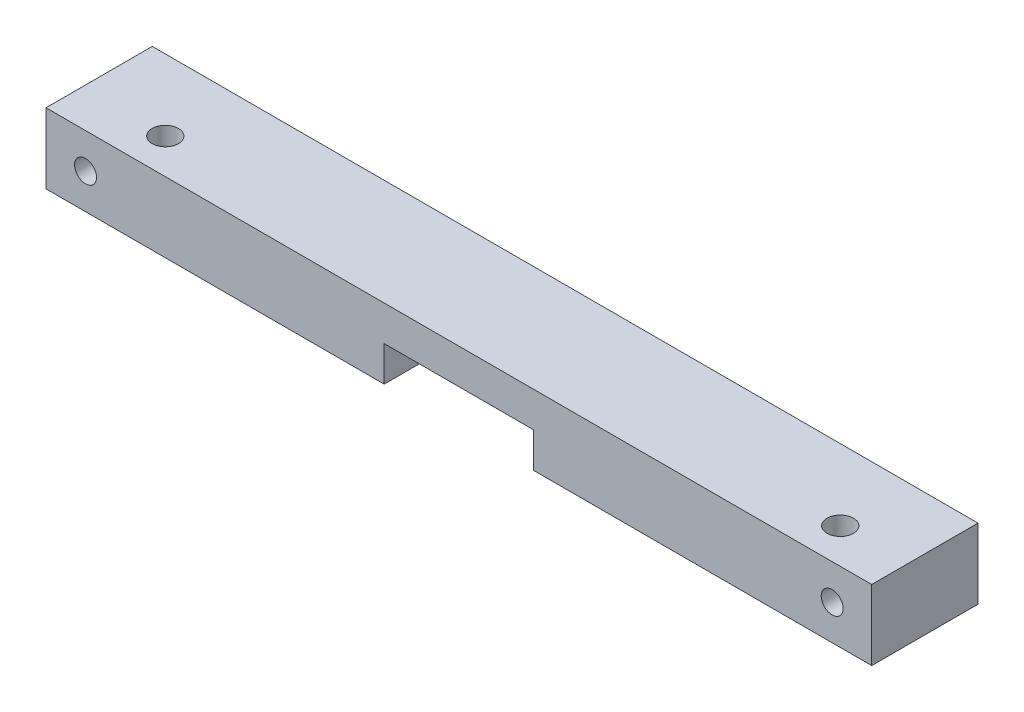
from build123d import *

# Parameters (mm, degrees)
SKETCH1_W                    = 38.421818
SKETCH1_H                    = 25.4
BOSS_EXTRUDE1_DEPTH          = 298.45
F_3_8_16_TAPPED_HOLE1_D      = 7.9375
F_3_8_0_375_DIAMETER_HOLE2_D = 9.525
SKETCH11_W                   = 53.975
SKETCH11_H                   = 38.421818
CUT_EXTRUDE2_DEPTH           = 12.7


with BuildPart() as part:
    # Sketch1 → Boss-Extrude1 (new body)
    with BuildSketch(Plane(origin=(0, 0, 0), x_dir=(0, 0, -1), z_dir=(1, 0, 0))):
        with Locations((19.210909, 12.7)):
            Rectangle(SKETCH1_W, SKETCH1_H)
    extrude(amount=BOSS_EXTRUDE1_DEPTH)

    # 3/8-16 Tapped Hole1 (through all)
    with Locations(Plane(origin=(0, 0, -38.421818), x_dir=(-1, 0, 0), z_dir=(0, 0, -1))):
        with Locations((-284.1625, 12.7), (-14.2875, 12.7)):
            Hole(F_3_8_16_TAPPED_HOLE1_D / 2)

    # 3/8 (0.375) Diameter Hole2 (through all)
    with Locations(Plane(origin=(0, 25.4, 0), x_dir=(1, 0, 0), z_dir=(0, 1, 0))):
        with Locations((30.4121566, 12.7), (274.3878434, 12.7)):
            Hole(F_3_8_0_375_DIAMETER_HOLE2_D / 2)

    # Sketch11 → Cut-Extrude2 (cut)
    with BuildSketch(Plane.XZ):
        with Locations((149.225, -19.210909)):
            Rectangle(SKETCH11_W, SKETCH11_H)
    extrude(amount=-CUT_EXTRUDE2_DEPTH, mode=Mode.SUBTRACT)


solid = part.part
